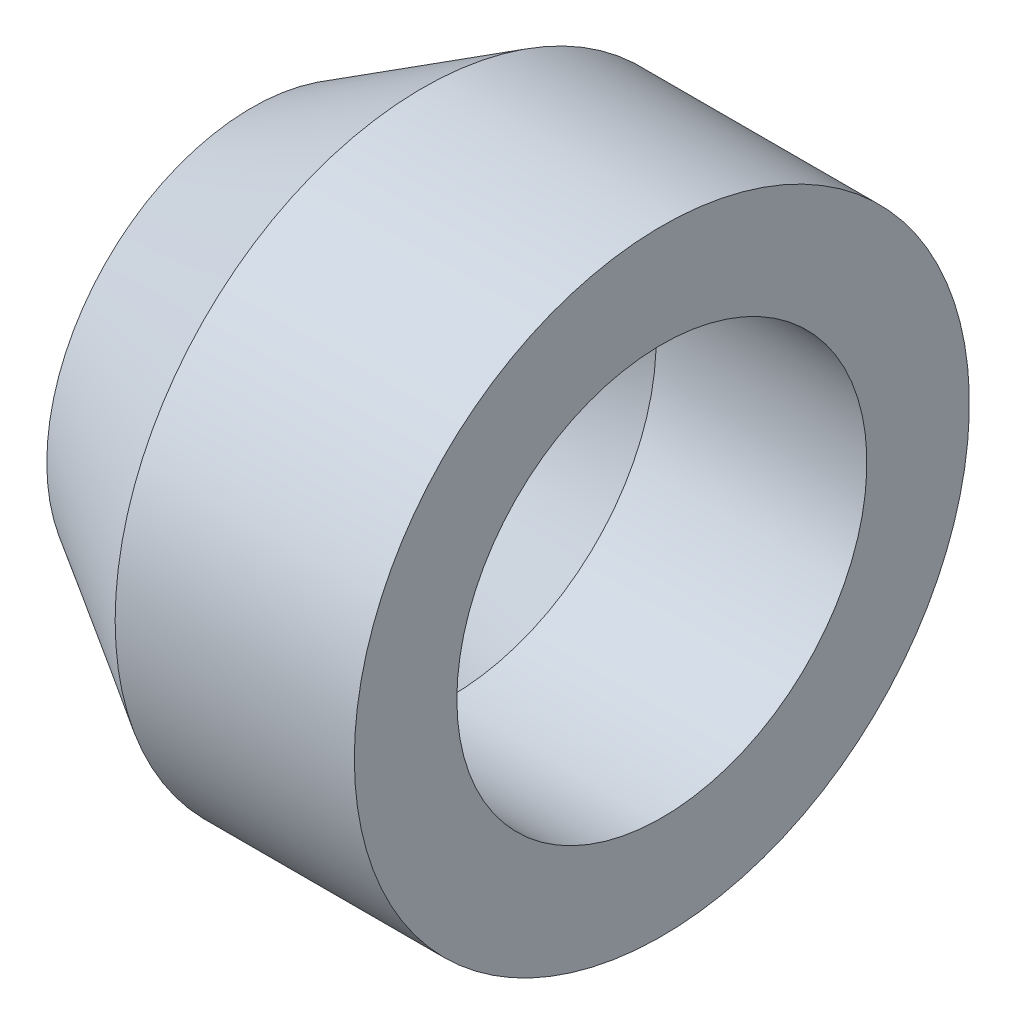
from build123d import *


with BuildPart() as part:
    # 草图1 → 旋转1 (revolve)
    with BuildSketch(Plane.XY, mode=Mode.PRIVATE) as revolve_1_sk:
        Polygon((-9, 4.301428863), (-9, 0), (-12, 0), (-12, 6), (-7, 9), (0, 9), (0, 6), (-6.169048105, 6), align=None)
    revolve(revolve_1_sk.sketch.rotate(Axis((-27.691233179, 0, 0), (1, 0, 0)), 90), axis=Axis((-27.691233179, 0, 0), (1, 0, 0)))


solid = part.part
